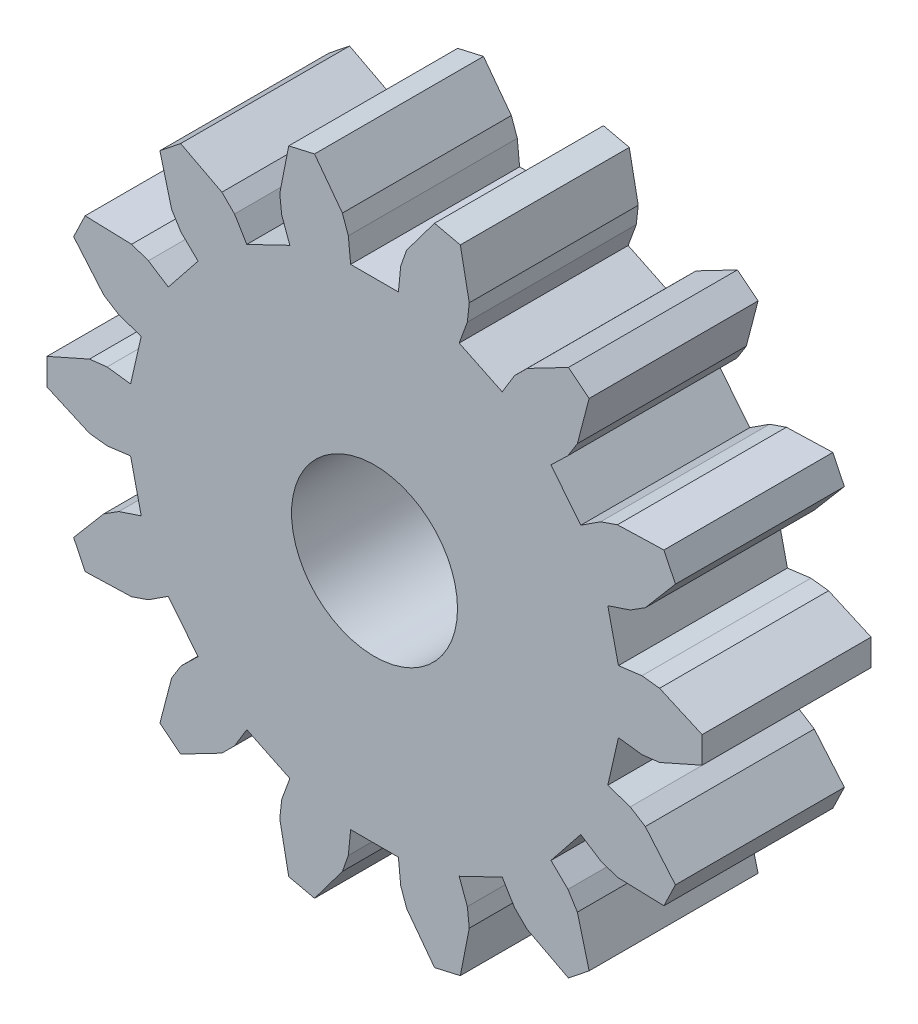
from build123d import *

# Parameters (mm, degrees)
MODEL_R             = 4.911595
BOSS_EXTRUDE1_DEPTH = 10


with BuildPart() as part:
    # Model → Boss-Extrude1 (new body)
    with BuildSketch(Plane.XY):
        Polygon((109.372327, 95.103157), (110.762604, 95.280824), (111.808486, 95.159378), (114.324954, 94.041578), (114.324954, 92.475166), (111.808486, 91.357365), (110.762604, 91.235919), (109.372327, 91.413587), (108.74316, 88.657038), (110.072845, 88.213892), (110.96246, 87.650678), (112.744724, 85.551724), (112.065082, 84.140432), (109.312829, 84.225186), (108.317826, 84.569557), (107.142317, 85.332849), (105.379438, 83.122268), (106.385168, 82.146081), (106.942314, 81.252653), (107.637374, 78.588263), (106.412702, 77.611622), (103.96978, 78.882138), (103.222733, 79.62412), (102.494814, 80.821857), (99.94738, 79.59508), (100.42996, 78.279193), (100.544289, 77.232507), (100.014481, 74.530399), (98.48734, 74.18184), (96.837602, 76.386481), (96.486466, 77.379116), (96.350314, 78.774073), (93.522876, 78.774073), (93.386724, 77.379116), (93.035588, 76.386481), (91.38585, 74.18184), (89.858709, 74.530399), (89.328902, 77.232507), (89.44323, 78.279193), (89.92581, 79.59508), (87.378376, 80.821857), (86.650457, 79.62412), (85.90341, 78.882138), (83.460488, 77.611622), (82.235816, 78.588263), (82.930876, 81.252653), (83.488022, 82.146081), (84.493752, 83.122268), (82.730873, 85.332849), (81.555364, 84.569557), (80.560362, 84.225186), (77.808108, 84.140432), (77.128466, 85.551724), (78.91073, 87.650678), (79.800346, 88.213892), (81.13003, 88.657038), (80.500863, 91.413587), (79.110586, 91.235919), (78.064704, 91.357365), (75.548236, 92.475166), (75.548236, 94.041578), (78.064704, 95.159378), (79.110586, 95.280824), (80.500863, 95.103157), (81.13003, 97.859706), (79.800346, 98.302851), (78.91073, 98.866065), (77.128466, 100.96502), (77.808108, 102.376311), (80.560362, 102.291557), (81.555364, 101.947187), (82.730873, 101.183894), (84.493752, 103.394476), (83.488022, 104.370663), (82.930876, 105.264091), (82.235816, 107.928481), (83.460488, 108.905122), (85.90341, 107.634605), (86.650457, 106.892623), (87.378376, 105.694886), (89.92581, 106.921664), (89.44323, 108.237551), (89.328902, 109.284237), (89.858709, 111.986345), (91.38585, 112.334904), (93.035588, 110.130263), (93.386724, 109.137628), (93.522876, 107.742671), (96.350314, 107.742671), (96.486466, 109.137628), (96.837602, 110.130263), (98.48734, 112.334904), (100.014481, 111.986345), (100.544289, 109.284237), (100.42996, 108.237551), (99.94738, 106.921664), (102.494814, 105.694886), (103.222733, 106.892623), (103.96978, 107.634605), (106.412702, 108.905122), (107.637374, 107.928481), (106.942314, 105.264091), (106.385168, 104.370663), (105.379438, 103.394476), (107.142317, 101.183894), (108.317826, 101.947187), (109.312829, 102.291557), (112.065082, 102.376311), (112.744724, 100.96502), (110.96246, 98.866065), (110.072845, 98.302851), (108.74316, 97.859706), align=None)
        with Locations((94.936589262, 93.258379)):
            Circle(MODEL_R, mode=Mode.SUBTRACT)
    extrude(amount=BOSS_EXTRUDE1_DEPTH)


solid = part.part
